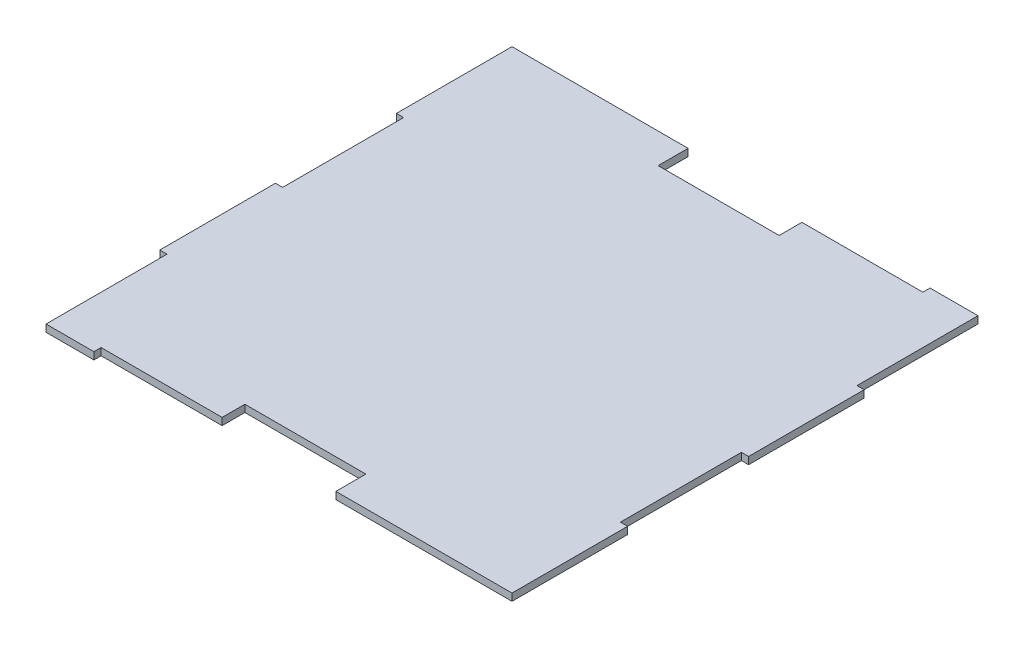
from build123d import *

# Parameters (mm, degrees)
BOSS_EXTRUDE1_DEPTH = 6


with BuildPart() as part:
    # Sketch1 → Boss-Extrude1 (new body)
    with BuildSketch(Plane(origin=(0, 0, 0), x_dir=(1, 0, 0), z_dir=(0, 1, 0))):
        Polygon((-191.5, -96.5), (-191.5, -197.5), (-151.5, -197.5), (-151.5, -191.5), (-50.5, -191.5), (-50.5, -172.5), (50.5, -172.5), (50.5, -197.5), (197.5, -197.5), (197.5, -101), (191.5, -101), (191.5, 0), (197.5, 0), (197.5, 96.5), (191.5, 96.5), (191.5, 197.5), (151.5, 197.5), (151.5, 191.5), (50.5, 191.5), (50.5, 172.5), (-50.5, 172.5), (-50.5, 197.5), (-197.5, 197.5), (-197.5, 101), (-191.5, 101), (-191.5, 0), (-197.5, 0), (-197.5, -96.5), align=None)
    extrude(amount=BOSS_EXTRUDE1_DEPTH)


solid = part.part
